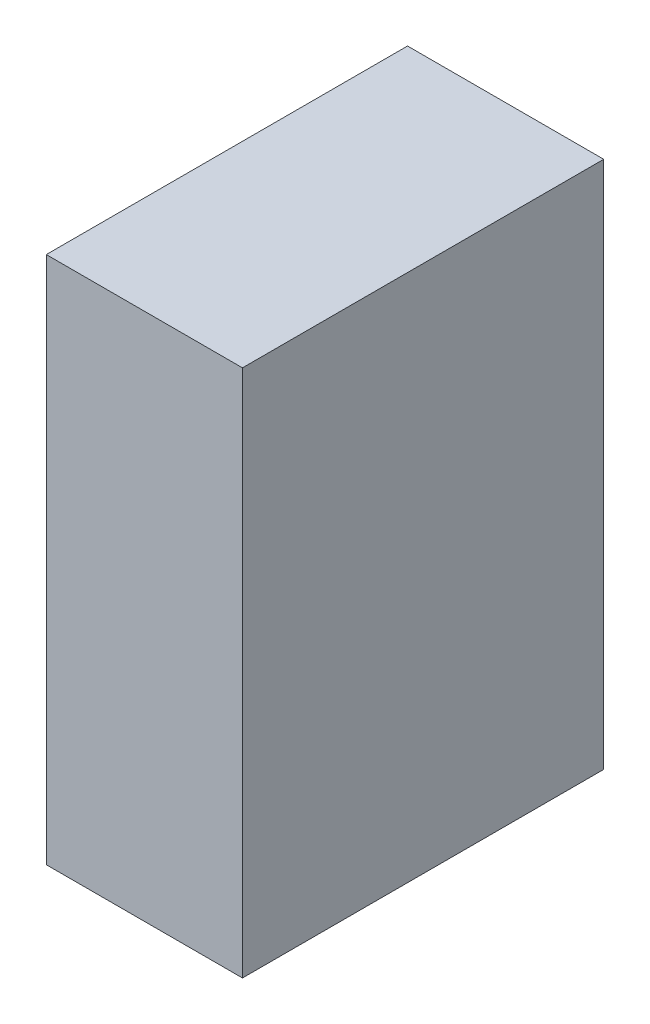
from build123d import *

# Parameters (mm, degrees)
SKETCH1_W           = 20.42
SKETCH1_H           = 37.6
BOSS_EXTRUDE1_DEPTH = 55


with BuildPart() as part:
    # Sketch1 → Boss-Extrude1 (new body)
    with BuildSketch(Plane(origin=(0, 0, 0), x_dir=(1, 0, 0), z_dir=(0, 1, 0))):
        with Locations((-26.033402264, -20.463685786)):
            Rectangle(SKETCH1_W, SKETCH1_H)
    extrude(amount=BOSS_EXTRUDE1_DEPTH)


solid = part.part
